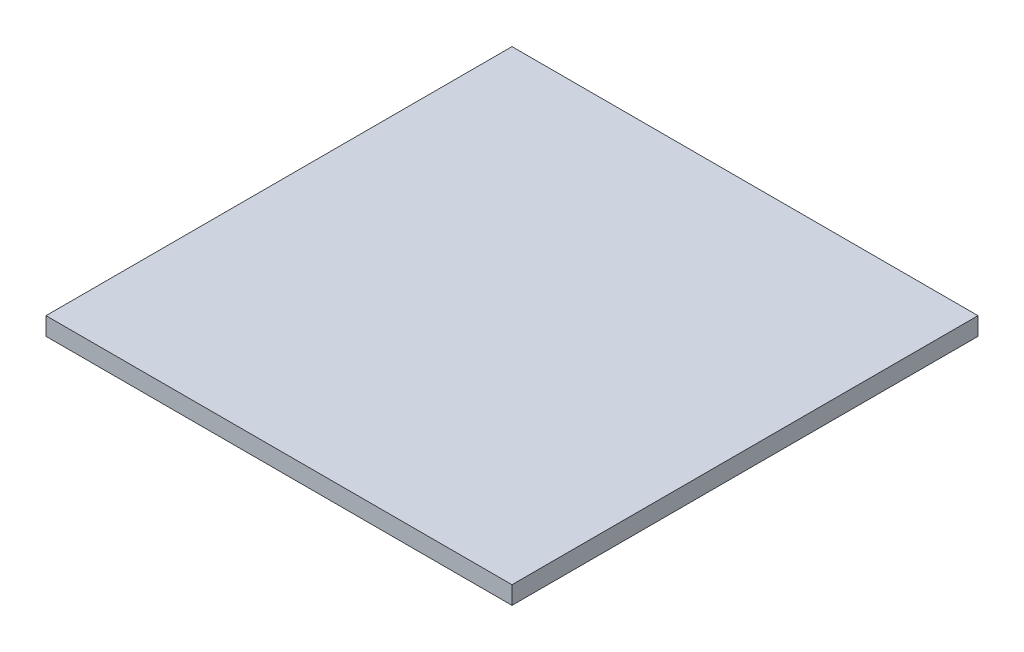
from build123d import *

# Parameters (mm, degrees)
SKETCH1_W           = 165
SKETCH1_H           = 165
BOSS_EXTRUDE1_DEPTH = 6.35


with BuildPart() as part:
    # Sketch1 → Boss-Extrude1 (new body)
    with BuildSketch(Plane(origin=(0, 0, 0), x_dir=(1, 0, 0), z_dir=(0, 1, 0))):
        Rectangle(SKETCH1_W, SKETCH1_H)
    extrude(amount=BOSS_EXTRUDE1_DEPTH)


solid = part.part
